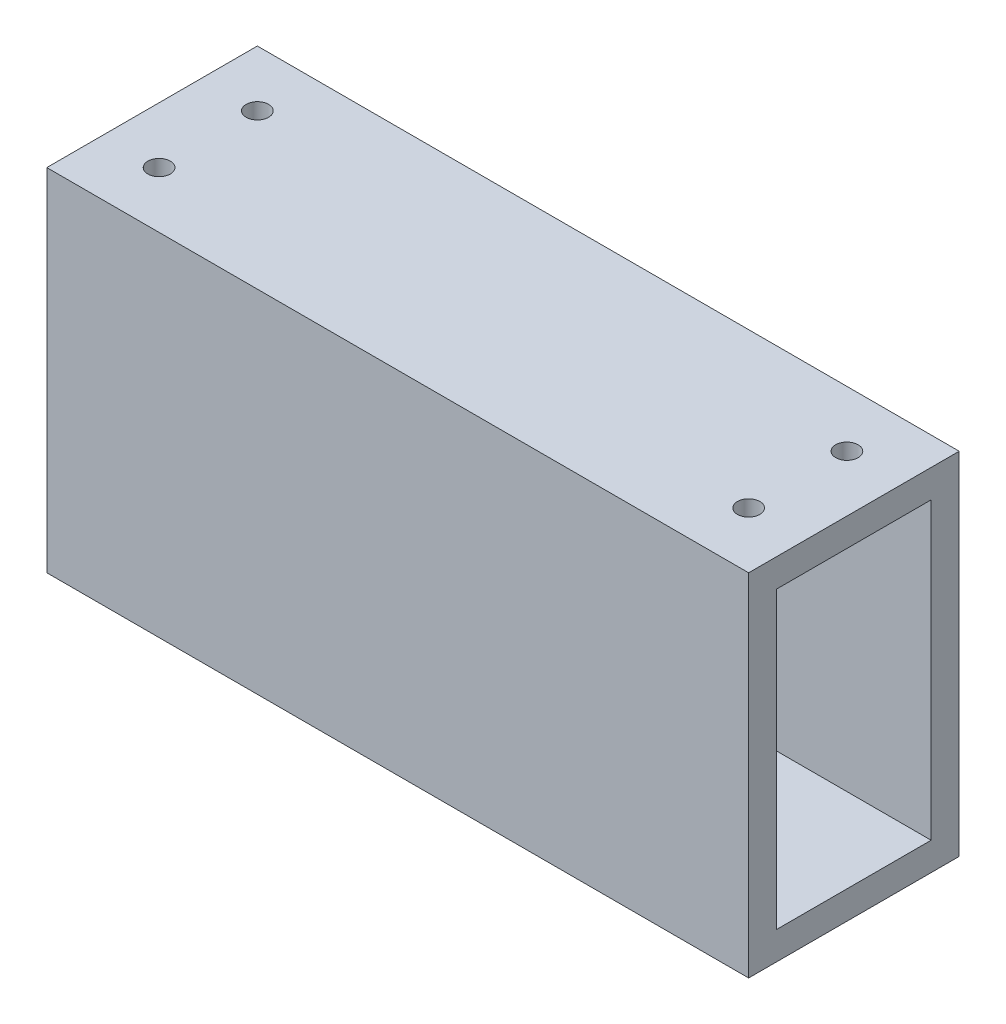
from build123d import *

# Parameters (mm, degrees)
SKETCH_1_W          = 100
SKETCH_1_H          = 30
EXTRUDE_1_DEPTH     = 50
SKETCH_2_W          = 22
SKETCH_2_H          = 42
CUT_EXTRUDE_1_DEPTH = 113.805141727
SKETCH_3_R          = 2.1
CUT_EXTRUDE_3_DEPTH = 20
SKETCH_4_R          = 1.6
CUT_EXTRUDE_4_DEPTH = 20


with BuildPart() as part:
    # 草图1 → 凸台-拉伸1 (new body)
    with BuildSketch(Plane(origin=(0, 0, 0), x_dir=(1, 0, 0), z_dir=(0, 1, 0))):
        Rectangle(SKETCH_1_W, SKETCH_1_H)
    extrude(amount=EXTRUDE_1_DEPTH)

    # 草图2 → 切除-拉伸1 (cut, through all)
    with BuildSketch(Plane.ZY.offset(50)):
        with Locations((0, 25)):
            Rectangle(SKETCH_2_W, SKETCH_2_H)
    extrude(amount=-CUT_EXTRUDE_1_DEPTH, mode=Mode.SUBTRACT)

    # 草图3 → 切除-拉伸3 (cut)
    with BuildSketch(Plane.XZ):
        with Locations(Location((13, 8, 0), (0, 0, 270))):
            Circle(SKETCH_3_R)
        with Locations(Location((-13, 8, 0), (0, 0, 270))):
            Circle(SKETCH_3_R)
    extrude(amount=-CUT_EXTRUDE_3_DEPTH, mode=Mode.SUBTRACT)

    # 草图4 → 切除-拉伸4 (cut)
    with BuildSketch(Plane(origin=(0, 50, 0), x_dir=(1, 0, 0), z_dir=(0, 1, 0))):
        with Locations(Location((-42, 7, 0), (0, 0, 270))):
            Circle(SKETCH_4_R)
        with Locations(Location((-42, -7, 0), (0, 0, 270))):
            Circle(SKETCH_4_R)
        with Locations(Location((42, 7, 0), (0, 0, 270))):
            Circle(SKETCH_4_R)
        with Locations(Location((42, -7, 0), (0, 0, 270))):
            Circle(SKETCH_4_R)
    extrude(amount=-CUT_EXTRUDE_4_DEPTH, mode=Mode.SUBTRACT)


solid = part.part
